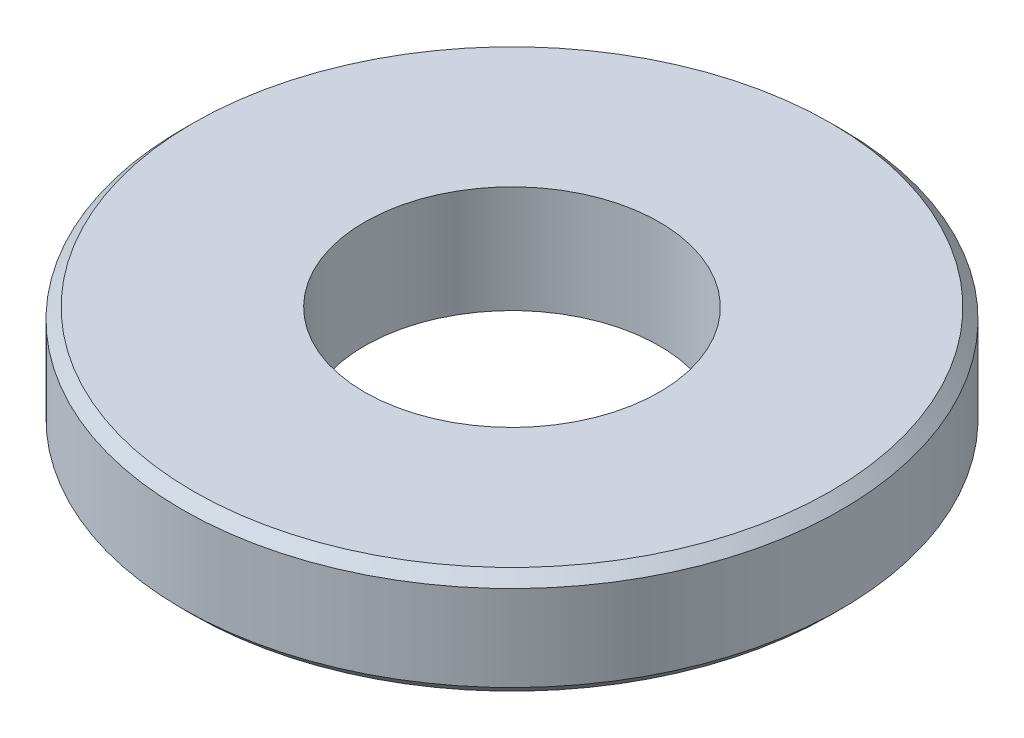
from build123d import *

# Parameters (mm, degrees)
SKETCH1_R           = 12.3
SKETCH1_R_2         = 5.5
BOSS_EXTRUDE1_DEPTH = 4
CHAMFER1_SIZE       = 0.4


with BuildPart() as part:
    # Sketch1 → Boss-Extrude1 (new body)
    with BuildSketch(Plane(origin=(0, 0, 0), x_dir=(1, 0, 0), z_dir=(0, 1, 0))):
        with Locations(Location((0, 0, 0), (0, 0, 270))):
            Circle(SKETCH1_R)
        with Locations(Location((0, 0, 0), (0, 0, 270))):
            Circle(SKETCH1_R_2, mode=Mode.SUBTRACT)
    extrude(amount=BOSS_EXTRUDE1_DEPTH)

    # Chamfer1
    chamfer1_edges = [part.edges().sort_by_distance(p)[0] for p in [
        (0, 0, -12.3),
        (0, 4, -12.3),
    ]]
    chamfer(chamfer1_edges, length=CHAMFER1_SIZE)


solid = part.part
